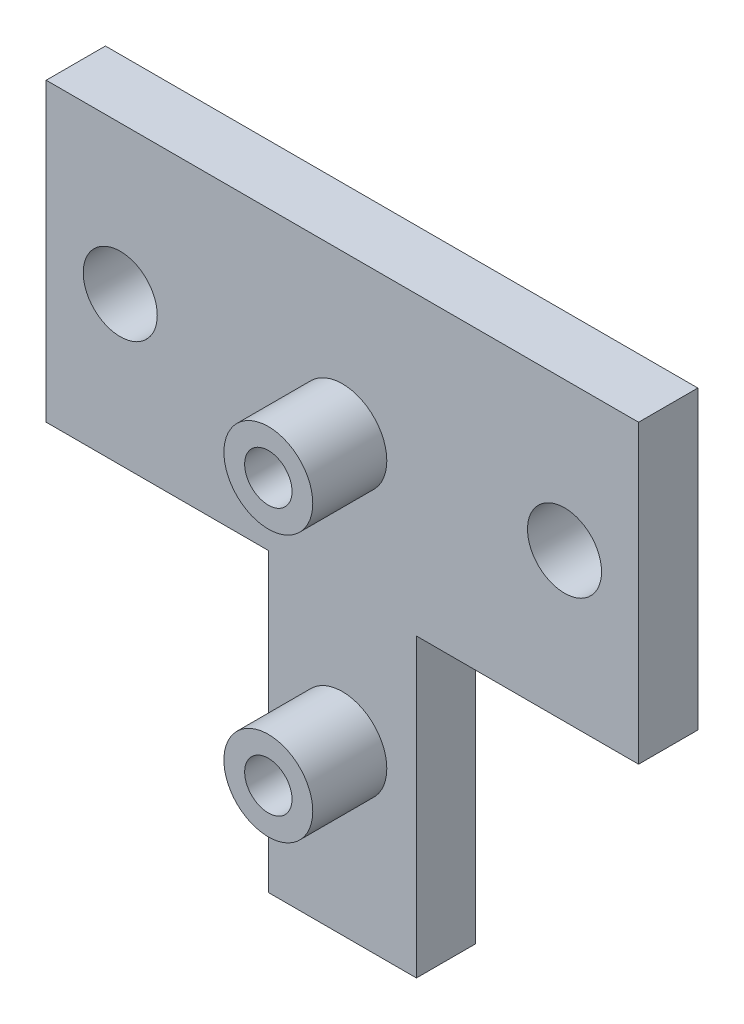
from build123d import *
from build123d.topology import SkipClean

# Parameters (mm, degrees)
SKETCH1_W           = 5
SKETCH1_H           = 2.8
SKETCH1_H_2         = 2
SKETCH1_W_2         = 15
SKETCH1_H_3         = 8.75
SKETCH1_H_4         = 9.25
SKETCH1_H_5         = 18
BOSS_EXTRUDE1_DEPTH = 4
SKETCH2_R           = 2.5
CUT_EXTRUDE1_DEPTH  = 13
SKETCH3_R           = 3
SKETCH3_R_2         = 1.6
BOSS_EXTRUDE2_DEPTH = 5
SKETCH4_R           = 2.5
CUT_EXTRUDE3_DEPTH  = 3


with BuildPart() as part:
    # Sketch1 → Boss-Extrude1 (new body)
    with BuildSketch(Plane.XY):
        with BuildLine():
            Line((-20, 0), (-15, 0))
            Line((-15, 0), (-15, 17.2))
            Line((-15, 17.2), (-20, 17.2))
            Line((-20, 17.2), (-20, 10.05))
            ThreePointArc((-20, 10.05), (-18.86862915, 9.58137085), (-18.4, 8.45))
            ThreePointArc((-18.4, 8.45), (-18.86862915, 7.31862915), (-20, 6.85))
            Line((-20, 6.85), (-20, 0))
        make_face()
        with BuildLine():
            Line((-20, 10.05), (-20, 17.2))
            Line((-20, 17.2), (-25, 17.2))
            Line((-25, 17.2), (-25, 8.45))
            Line((-25, 8.45), (-21.6, 8.45))
            ThreePointArc((-21.6, 8.45), (-21.13137085, 9.58137085), (-20, 10.05))
        make_face()
        with BuildLine():
            Line((-25, 0), (-20, 0))
            Line((-20, 0), (-20, 6.85))
            ThreePointArc((-20, 6.85), (-21.13137085, 7.31862915), (-21.6, 8.45))
            Line((-21.6, 8.45), (-25, 8.45))
            Line((-25, 8.45), (-25, 0))
        make_face()
        with Locations((-22.5, -1.4)):
            Rectangle(SKETCH1_W, SKETCH1_H)
        with Locations((-17.5, -1.4)):
            Rectangle(SKETCH1_W, SKETCH1_H)
        with BuildLine():
            Line((-20, 17.2), (-15, 17.2))
            Line((-15, 17.2), (-15, 35.2))
            Line((-15, 35.2), (-20, 35.2))
            Line((-20, 35.2), (-20, 28.05))
            ThreePointArc((-20, 28.05), (-18.86862915, 27.58137085), (-18.4, 26.45))
            ThreePointArc((-18.4, 26.45), (-18.86862915, 25.31862915), (-20, 24.85))
            Line((-20, 24.85), (-20, 17.2))
        make_face()
        with BuildLine():
            Line((-25, 17.2), (-20, 17.2))
            Line((-20, 17.2), (-20, 24.85))
            ThreePointArc((-20, 24.85), (-21.13137085, 25.31862915), (-21.6, 26.45))
            Line((-21.6, 26.45), (-25, 26.45))
            Line((-25, 26.45), (-25, 17.2))
        make_face()
        with BuildLine():
            Line((-20, 28.05), (-20, 35.2))
            Line((-20, 35.2), (-25, 35.2))
            Line((-25, 35.2), (-25, 26.45))
            Line((-25, 26.45), (-21.6, 26.45))
            ThreePointArc((-21.6, 26.45), (-21.13137085, 27.58137085), (-20, 28.05))
        make_face()
        with Locations((-17.5, 36.2)):
            Rectangle(SKETCH1_W, SKETCH1_H_2)
        with Locations((-22.5, 36.2)):
            Rectangle(SKETCH1_W, SKETCH1_H_2)
        with Locations((-7.5, 36.2)):
            Rectangle(SKETCH1_W_2, SKETCH1_H_2)
        with Locations((-32.5, 36.2)):
            Rectangle(SKETCH1_W_2, SKETCH1_H_2)
        with Locations((-32.5, 30.825)):
            Rectangle(SKETCH1_W_2, SKETCH1_H_3)
        with Locations((-32.5, 21.825)):
            Rectangle(SKETCH1_W_2, SKETCH1_H_4)
        with Locations((-7.5, 26.2)):
            Rectangle(SKETCH1_W_2, SKETCH1_H_5)
    extrude(amount=BOSS_EXTRUDE1_DEPTH)

    # Sketch2 → Cut-Extrude1 (cut)
    with BuildSketch(Plane.XY.offset(4)):
        with Locations((-35, 27.2)):
            Circle(SKETCH2_R)
        with Locations((-5, 27.2)):
            Circle(SKETCH2_R)
    extrude(amount=-CUT_EXTRUDE1_DEPTH, mode=Mode.SUBTRACT)

    # Sketch3 → Boss-Extrude2 (add)
    # profile 1 of 2: a face of its own
    with SkipClean():  # the faces are left unmerged after this step: merging them gives an invalid solid
        with BuildSketch(Plane.XY.offset(4)):
            with Locations((-20, 26.45)):
                Circle(SKETCH3_R)
            with Locations((-20, 26.45)):
                Circle(SKETCH3_R_2, mode=Mode.SUBTRACT)
        # profile 2 of 2: a face of its own
        with BuildSketch(Plane.XY.offset(4)):
            with Locations((-20, 8.45)):
                Circle(SKETCH3_R)
            with Locations((-20, 8.45)):
                Circle(SKETCH3_R_2, mode=Mode.SUBTRACT)
        extrude(amount=BOSS_EXTRUDE2_DEPTH)

    # Sketch4 → Cut-Extrude3 (cut)
    with SkipClean():  # the faces are left unmerged after this step: merging them gives an invalid solid
        with BuildSketch(Plane(origin=(0, 0, 0), x_dir=(-1, 0, 0), z_dir=(0, 0, -1))):
            with Locations((20, 26.45)):
                Circle(SKETCH4_R)
            with Locations((20, 8.45)):
                Circle(SKETCH4_R)
        extrude(amount=-CUT_EXTRUDE3_DEPTH, mode=Mode.SUBTRACT)


solid = part.part
